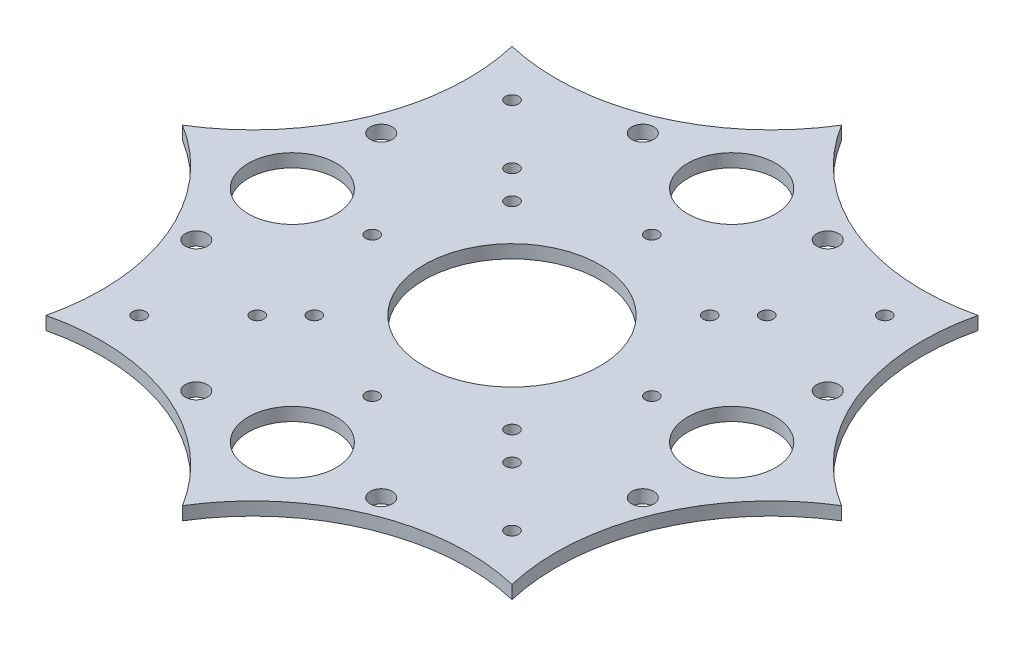
from build123d import *

# Parameters (mm, degrees)
SKETCH_1_R      = 1.5
SKETCH_1_R_2    = 20
SKETCH_1_R_3    = 2.5
SKETCH_1_R_4    = 10
EXTRUDE_2_DEPTH = 3


with BuildPart() as part:
    # 草圖1 → 填料-伸長2 (new body)
    with BuildSketch(Plane(origin=(0, 0, 0), x_dir=(1, 0, 0), z_dir=(0, 1, 0))):
        with BuildLine():
            ThreePointArc((-53.033008589, 53.033008589), (-22.961005942, 55.432771951), (0, 75))
            ThreePointArc((0, 75), (22.961005942, 55.432771951), (53.033008589, 53.033008589))
            ThreePointArc((53.033008589, 53.033008589), (55.432771951, 22.961005942), (75, 0))
            ThreePointArc((75, 0), (55.432771951, -22.961005942), (53.033008589, -53.033008589))
            ThreePointArc((53.033008589, -53.033008589), (22.961005942, -55.432771951), (0, -75))
            ThreePointArc((0, -75), (-22.961005942, -55.432771951), (-53.033008589, -53.033008589))
            ThreePointArc((-53.033008589, -53.033008589), (-55.432771951, -22.961005942), (-75, 0))
            ThreePointArc((-75, 0), (-55.432771951, 22.961005942), (-53.033008589, 53.033008589))
        make_face()
        with Locations(Location((-42.426406871, 42.426406871, 0), (0, 0, 270))):
            Circle(SKETCH_1_R, mode=Mode.SUBTRACT)
        with Locations(Location((-28.991378029, 28.991378029, 0), (0, 0, 270))):
            Circle(SKETCH_1_R, mode=Mode.SUBTRACT)
        with Locations(Location((28.991378029, -28.991378029, 0), (0, 0, 270))):
            Circle(SKETCH_1_R, mode=Mode.SUBTRACT)
        with Locations(Location((42.426406871, -42.426406871, 0), (0, 0, 270))):
            Circle(SKETCH_1_R, mode=Mode.SUBTRACT)
        with Locations(Location((42.426406871, 42.426406871, 0), (0, 0, 270))):
            Circle(SKETCH_1_R, mode=Mode.SUBTRACT)
        with Locations(Location((28.991378029, 28.991378029, 0), (0, 0, 270))):
            Circle(SKETCH_1_R, mode=Mode.SUBTRACT)
        with Locations(Location((-28.991378029, -28.991378029, 0), (0, 0, 270))):
            Circle(SKETCH_1_R, mode=Mode.SUBTRACT)
        with Locations(Location((-42.426406871, -42.426406871, 0), (0, 0, 270))):
            Circle(SKETCH_1_R, mode=Mode.SUBTRACT)
        with Locations(Location((0, 0, 0), (0, 0, 270))):
            Circle(SKETCH_1_R_2, mode=Mode.SUBTRACT)
        with Locations(Location((0, 31.819805153, 0), (0, 0, 270))):
            Circle(SKETCH_1_R, mode=Mode.SUBTRACT)
        with Locations(Location((31.819805153, 0, 0), (0, 0, 270))):
            Circle(SKETCH_1_R, mode=Mode.SUBTRACT)
        with Locations(Location((22.5, 22.5, 0), (0, 0, 270))):
            Circle(SKETCH_1_R, mode=Mode.SUBTRACT)
        with Locations(Location((0, -31.819805153, 0), (0, 0, 270))):
            Circle(SKETCH_1_R, mode=Mode.SUBTRACT)
        with Locations(Location((-22.5, -22.5, 0), (0, 0, 270))):
            Circle(SKETCH_1_R, mode=Mode.SUBTRACT)
        with Locations(Location((-31.819805153, 0, 0), (0, 0, 270))):
            Circle(SKETCH_1_R, mode=Mode.SUBTRACT)
        with Locations(Location((-22.5, 22.5, 0), (0, 0, 270))):
            Circle(SKETCH_1_R, mode=Mode.SUBTRACT)
        with Locations(Location((22.5, -22.5, 0), (0, 0, 270))):
            Circle(SKETCH_1_R, mode=Mode.SUBTRACT)
        with Locations(Location((-21.04758878, 50.813374288, 0), (0, 0, 270))):
            Circle(SKETCH_1_R_3, mode=Mode.SUBTRACT)
        with Locations(Location((21.04758878, 50.813374288, 0), (0, 0, 270))):
            Circle(SKETCH_1_R_3, mode=Mode.SUBTRACT)
        with Locations(Location((50.813374288, 21.04758878, 0), (0, 0, 270))):
            Circle(SKETCH_1_R_3, mode=Mode.SUBTRACT)
        with Locations(Location((50.813374288, -21.04758878, 0), (0, 0, 270))):
            Circle(SKETCH_1_R_3, mode=Mode.SUBTRACT)
        with Locations(Location((21.04758878, -50.813374288, 0), (0, 0, 270))):
            Circle(SKETCH_1_R_3, mode=Mode.SUBTRACT)
        with Locations(Location((-21.04758878, -50.813374288, 0), (0, 0, 270))):
            Circle(SKETCH_1_R_3, mode=Mode.SUBTRACT)
        with Locations(Location((-50.813374288, -21.04758878, 0), (0, 0, 270))):
            Circle(SKETCH_1_R_3, mode=Mode.SUBTRACT)
        with Locations(Location((-50.813374288, 21.04758878, 0), (0, 0, 270))):
            Circle(SKETCH_1_R_3, mode=Mode.SUBTRACT)
        with Locations(Location((0, 50, 0), (0, 0, 270))):
            Circle(SKETCH_1_R_4, mode=Mode.SUBTRACT)
        with Locations(Location((50, 0, 0), (0, 0, 270))):
            Circle(SKETCH_1_R_4, mode=Mode.SUBTRACT)
        with Locations(Location((0, -50, 0), (0, 0, 270))):
            Circle(SKETCH_1_R_4, mode=Mode.SUBTRACT)
        with Locations(Location((-50, 0, 0), (0, 0, 270))):
            Circle(SKETCH_1_R_4, mode=Mode.SUBTRACT)
    extrude(amount=EXTRUDE_2_DEPTH)


solid = part.part
